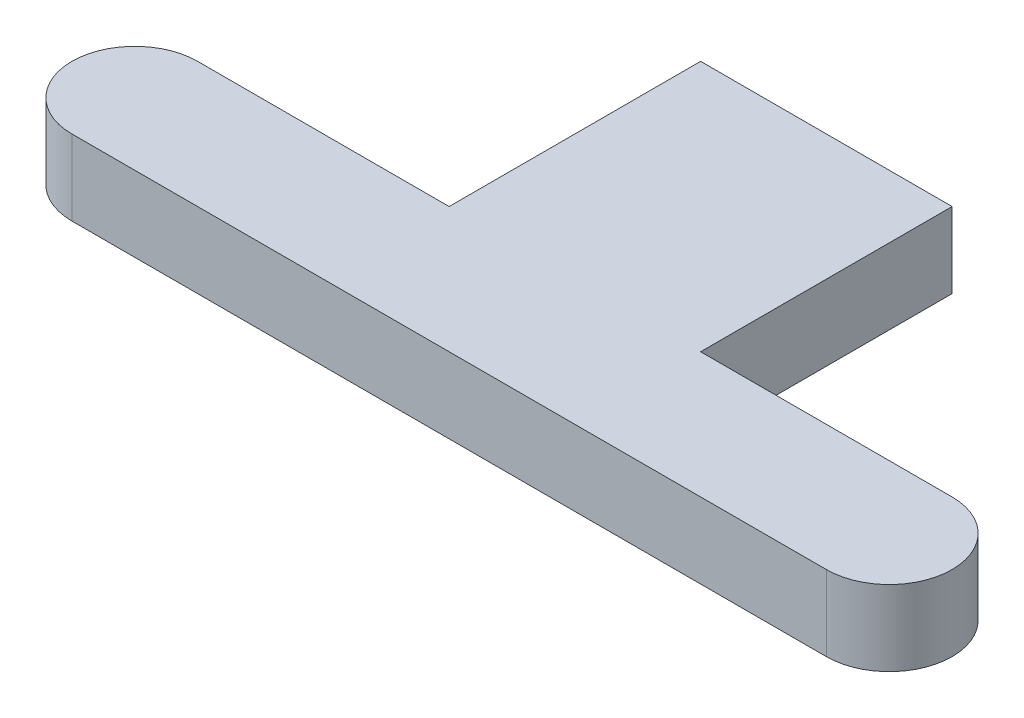
from build123d import *

# Parameters (mm, degrees)
BOSS_EXTRUDE1_DEPTH = 3
CUT_EXTRUDE1_DEPTH  = 1.5
SKETCH4_W           = 10
SKETCH4_H           = 3
BOSS_EXTRUDE3_DEPTH = 10


with BuildPart() as part:
    # Sketch1 → Boss-Extrude1 (new body)
    with BuildSketch(Plane(origin=(0, 0, 0), x_dir=(1, 0, 0), z_dir=(0, 1, 0))):
        with BuildLine():
            Line((-7.499999551, 0), (22.5, 0))
            ThreePointArc((22.5, 0), (25, 2.5), (22.5, 5))
            Line((22.5, 5), (-7.5, 5))
            ThreePointArc((-7.5, 5), (-10, 2.499999775), (-7.499999551, 0))
        make_face()
    extrude(amount=BOSS_EXTRUDE1_DEPTH)

    # Sketch2 → Cut-Extrude1 (cut)
    with BuildSketch(Plane.XZ):
        with BuildLine():
            Line((-7.5, -4), (22.5, -4))
            ThreePointArc((22.5, -4), (24, -2.5), (22.5, -1))
            Line((22.5, -1), (-7.49999973, -1))
            ThreePointArc((-7.49999973, -1), (-9, -2.499999865), (-7.5, -4))
        make_face()
    extrude(amount=-CUT_EXTRUDE1_DEPTH, mode=Mode.SUBTRACT)

    # Sketch4 → Boss-Extrude3 (add)
    with BuildSketch(Plane(origin=(0, 0, -5), x_dir=(-1, 0, 0), z_dir=(0, 0, -1))):
        with Locations((-7.5, 1.5)):
            Rectangle(SKETCH4_W, SKETCH4_H)
    extrude(amount=BOSS_EXTRUDE3_DEPTH)


solid = part.part
